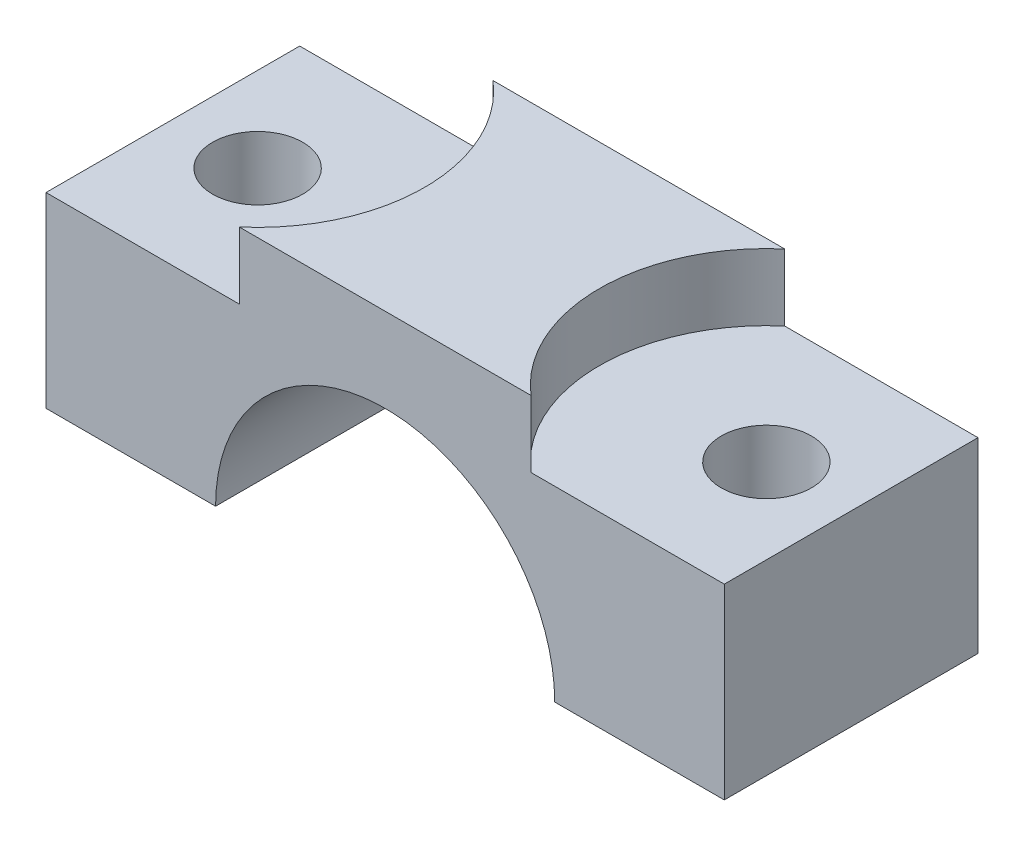
from build123d import *

# Parameters (mm, degrees)
BOSS_EXTRUDE1_DEPTH                           = 9.5
CBORE_FOR_M12_HEX_HEAD_CAP_SCREW1_D           = 6.75
CBORE_FOR_M12_HEX_HEAD_CAP_SCREW1_DEPTH       = 325.28
CBORE_FOR_M12_HEX_HEAD_CAP_SCREW1_CBORE_D     = 25
CBORE_FOR_M12_HEX_HEAD_CAP_SCREW1_CBORE_DEPTH = 5
CBORE_FOR_M12_HEX_HEAD_CAP_SCREW1_TIP         = 2.027904589


with BuildPart() as part:
    # Sketch1 → Boss-Extrude1 (new, symmetric)
    with BuildSketch(Plane.XY):
        with BuildLine():
            Line((25.4, 9.5), (-25.4, 9.5))
            Line((-25.4, 9.5), (-25.4, -9.5))
            Line((-25.4, -9.5), (-12.7, -9.5))
            ThreePointArc((-12.7, -9.5), (0, 3.2), (12.7, -9.5))
            Line((12.7, -9.5), (25.4, -9.5))
            Line((25.4, -9.5), (25.4, 9.5))
        make_face()
    extrude(amount=BOSS_EXTRUDE1_DEPTH, both=True)

    # CBORE for M12 Hex Head Cap Screw1
    with Locations(Plane(origin=(19.05, 9.5, 0), x_dir=(0, 0, 1), z_dir=(0, 1, 0))):
        with Locations((0, 0), (0, -38.1)):
            CounterBoreHole(CBORE_FOR_M12_HEX_HEAD_CAP_SCREW1_D / 2, CBORE_FOR_M12_HEX_HEAD_CAP_SCREW1_CBORE_D / 2, CBORE_FOR_M12_HEX_HEAD_CAP_SCREW1_CBORE_DEPTH, depth=CBORE_FOR_M12_HEX_HEAD_CAP_SCREW1_DEPTH)
            with Locations((0, 0, -(CBORE_FOR_M12_HEX_HEAD_CAP_SCREW1_DEPTH + CBORE_FOR_M12_HEX_HEAD_CAP_SCREW1_TIP / 2))):  # 118° drill point
                Cone(0, CBORE_FOR_M12_HEX_HEAD_CAP_SCREW1_D / 2, CBORE_FOR_M12_HEX_HEAD_CAP_SCREW1_TIP, mode=Mode.SUBTRACT)


solid = part.part
